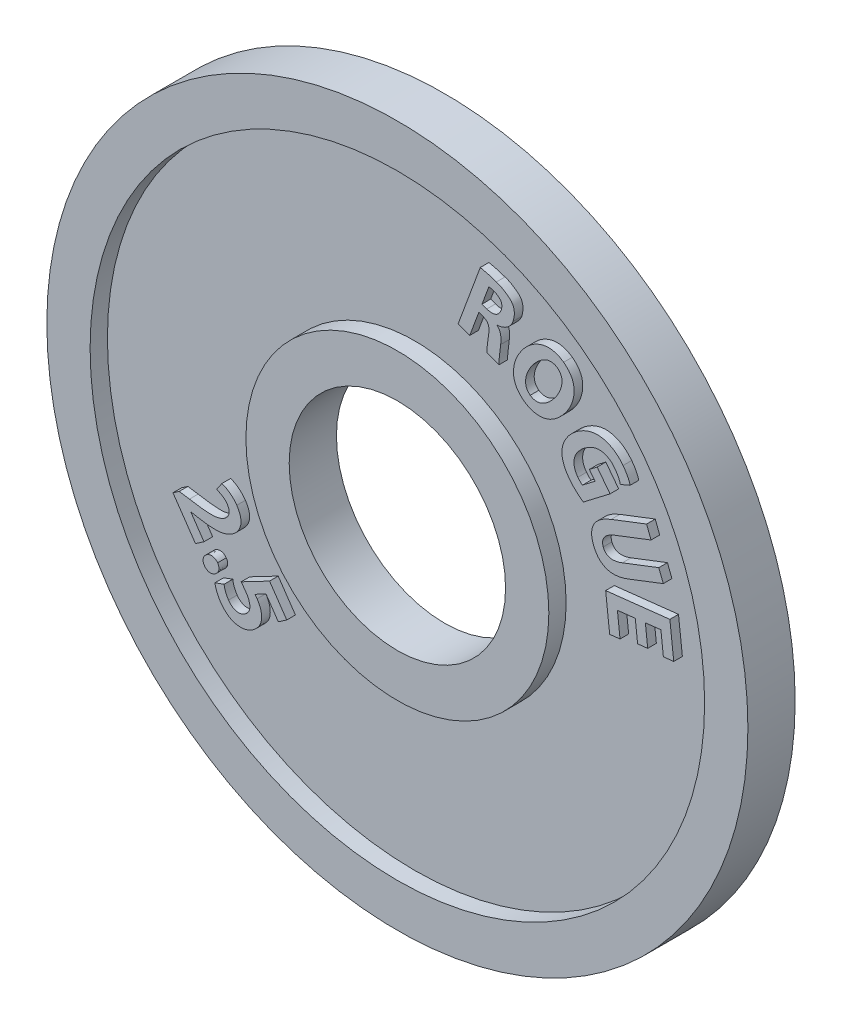
from build123d import *

# Parameters (mm, degrees)
BOSS_EXTRUDE1_DEPTH      = 5.461
BOSS_EXTRUDE1_DEPTH_BACK = 5.461
SKETCH1_R                = 81
SKETCH1_R_2              = 25
SKETCH2_R                = 71
SKETCH2_R_2              = 35
CUT_EXTRUDE1_DEPTH       = 4.0005
BOSS_EXTRUDE2_DEPTH      = 2
BOSS_EXTRUDE3_DEPTH      = 2


with BuildPart() as part:
    # Sketch1 → Boss-Extrude1 (new, two sides: drawn at the far end of the back side and taken through both)
    with BuildSketch(Plane.XY.offset(-BOSS_EXTRUDE1_DEPTH_BACK)):
        Circle(SKETCH1_R)
        Circle(SKETCH1_R_2, mode=Mode.SUBTRACT)
    extrude(amount=BOSS_EXTRUDE1_DEPTH + BOSS_EXTRUDE1_DEPTH_BACK)

    # Sketch2 → Cut-Extrude1 (cut)
    with BuildSketch(Plane.XY.offset(5.461)):
        Circle(SKETCH2_R)
        Circle(SKETCH2_R_2, mode=Mode.SUBTRACT)
    cut_extrude1 = extrude(amount=-CUT_EXTRUDE1_DEPTH, mode=Mode.SUBTRACT)

    # Mirror1: Cut-Extrude1 across plane
    add(cut_extrude1.mirror(Plane.XY), mode=Mode.SUBTRACT)

    # Sketch3 → Boss-Extrude2 (add)
    # profile 1 of 5: a face of its own
    with BuildSketch(Plane.XY.offset(1.4605)):
        Polygon((48.839860313, 6.484164034), (52.968569495, 6.947410841), (53.511910375, 2.104859417), (55.846367436, 2.366788686), (55.303026555, 7.20934011), (58.891530797, 7.611975185), (59.467342249, 2.480028258), (61.85967841, 2.748451641), (60.963490663, 10.735767535), (46.127147855, 9.071109617), (47.057970878, 0.775105187), (49.450307039, 1.04352857), align=None)
    # profile 2 of 5: a face of its own
    with BuildSketch(Plane.XY.offset(1.4605)):
        with BuildLine():
            Line((58.408868098, 19.800082667), (49.987467181, 16.550679829))
            add(Edge.make_bspline(
                [(49.987467181, 16.550679829), (49.837686292, 16.49488334), (49.548503275, 16.387156666), (49.120650997, 16.259060183), (48.718130875, 16.157531015), (48.3383113, 16.094060034), (47.983737391, 16.055501164), (47.652478383, 16.047671174), (47.345604822, 16.076303263), (47.061807344, 16.131748126), (46.800297945, 16.216353411), (46.561420144, 16.329299607), (46.342241739, 16.4653803), (46.142932545, 16.625909936), (45.969496065, 16.816772156), (45.812660014, 17.029630844), (45.677584634, 17.26830529), (45.607777094, 17.441104297), (45.572237794, 17.52907697)],
                knots=[0, 0, 0, 0, 1.497104005, 2.890469246, 4.182170157, 5.38371335, 6.495092621, 7.521788302, 8.482159144, 9.376924377, 10.225954568, 11.05018717, 11.846294255, 12.63832965, 13.439256997, 14.255276399, 15.111754169, 16, 16, 16, 16], degree=3))
            add(Edge.make_bspline(
                [(45.572237794, 17.52907697), (45.54110301, 17.614613658), (45.479774266, 17.783102301), (45.425508923, 18.04191056), (45.396491838, 18.297399563), (45.411182685, 18.549352457), (45.448399927, 18.799047872), (45.523898445, 19.044679467), (45.628212982, 19.288379268), (45.767214883, 19.527576303), (45.939321995, 19.76221404), (46.150349026, 19.988333827), (46.399430665, 20.207407096), (46.68514051, 20.419636496), (47.00915993, 20.62261618), (47.369864522, 20.818593857), (47.768038655, 21.009888345), (48.05044791, 21.124827032), (48.196265949, 21.184174004)],
                knots=[0, 0, 0, 0, 0.860359369, 1.694720544, 2.496292306, 3.285820064, 4.075497019, 4.880198023, 5.709886719, 6.579371814, 7.492216528, 8.457987856, 9.500110658, 10.627382014, 11.822294646, 13.115197334, 14.510472797, 16, 16, 16, 16], degree=3))
            Line((48.196265949, 21.184174004), (56.619949546, 24.436380807))
            Line((56.619949546, 24.436380807), (55.585731009, 27.116740669))
            Line((55.585731009, 27.116740669), (47.399767106, 23.958181351))
            add(Edge.make_bspline(
                [(47.399767106, 23.958181351), (47.154468324, 23.857841529), (46.680005497, 23.663761822), (46.013535972, 23.332747275), (45.408284071, 22.990328032), (44.872169211, 22.619822167), (44.397428848, 22.23386378), (43.988947507, 21.825444317), (43.64911132, 21.394638236), (43.369378637, 20.946391713), (43.160285524, 20.475854365), (43.000879597, 19.991825463), (42.911244595, 19.488861108), (42.872193892, 18.97068588), (42.901362444, 18.436644787), (42.982505426, 17.885841772), (43.12766595, 17.319156982), (43.263407489, 16.943659535), (43.333104561, 16.75085877)],
                knots=[0, 0, 0, 0, 1.344863254, 2.601266986, 3.774593576, 4.87164201, 5.905128389, 6.876547377, 7.797123993, 8.68497585, 9.55087214, 10.40474598, 11.26530219, 12.137400202, 13.036845566, 13.973989001, 14.959736017, 16, 16, 16, 16], degree=3))
            add(Edge.make_bspline(
                [(43.333104561, 16.75085877), (43.410974278, 16.558161721), (43.562516745, 16.183153476), (43.844818406, 15.660755193), (44.154999178, 15.184613707), (44.505743366, 14.763642724), (44.882641693, 14.386507135), (45.300458995, 14.06841769), (45.749073959, 13.796649982), (46.232035934, 13.575774786), (46.748993972, 13.412846067), (47.299529988, 13.307875723), (47.882920851, 13.26868844), (48.499149791, 13.285968288), (49.147370666, 13.367682561), (49.828539989, 13.507641829), (50.544515776, 13.703666651), (51.024632026, 13.877108014), (51.272615873, 13.966691852)],
                knots=[0, 0, 0, 0, 1.039558933, 2.023088435, 2.966935064, 3.879187077, 4.760868502, 5.629975167, 6.500584746, 7.381580594, 8.281428687, 9.207176976, 10.180014645, 11.202256596, 12.288320077, 13.445692329, 14.680679849, 16, 16, 16, 16], degree=3))
            Line((51.272615873, 13.966691852), (59.443086636, 17.119722805))
            Line((59.443086636, 17.119722805), (58.408868098, 19.800082667))
        make_face()
    # profile 3 of 5: a face of its own
    with BuildSketch(Plane.XY.offset(1.4605)):
        with BuildLine():
            Line((44.16869194, 32.812577076), (42.364340607, 31.432911175))
            Line((42.364340607, 31.432911175), (43.67325441, 29.72109068))
            Line((43.67325441, 29.72109068), (40.773954833, 27.504191626))
            add(Edge.make_bspline(
                [(40.773954833, 27.504191626), (40.738610855, 27.523476593), (40.66310176, 27.564677116), (40.549992084, 27.645146529), (40.430183159, 27.747061059), (40.30098144, 27.868198142), (40.163522503, 28.009091505), (40.017629222, 28.169555821), (39.863059002, 28.349445795), (39.759411543, 28.477686355), (39.705441227, 28.544462558)],
                knots=[0, 0, 0, 0, 0.643595579, 1.374981614, 2.215029152, 3.158253785, 4.206916651, 5.362660204, 6.626709559, 8, 8, 8, 8], degree=3))
            add(Edge.make_bspline(
                [(39.705441227, 28.544462558), (39.614773346, 28.66915258), (39.437486609, 28.912964246), (39.220660412, 29.301883288), (39.047396584, 29.696763542), (38.92006783, 30.100854635), (38.838237374, 30.512561551), (38.801731284, 30.931718599), (38.809722034, 31.357619845), (38.867480914, 31.788785059), (38.969712517, 32.223645464), (39.132564733, 32.65460533), (39.347717872, 33.080901592), (39.617738585, 33.501167657), (39.940057359, 33.917692646), (40.315146854, 34.330542904), (40.744066858, 34.740171787), (41.059601631, 34.997125753), (41.222545299, 35.129818013)],
                knots=[0, 0, 0, 0, 0.969838496, 1.89636616, 2.796694835, 3.680522693, 4.558095135, 5.434002503, 6.324412732, 7.234112482, 8.167870944, 9.130460798, 10.127095065, 11.168898237, 12.27028591, 13.439011954, 14.677493503, 16, 16, 16, 16], degree=3))
            add(Edge.make_bspline(
                [(41.222545299, 35.129818013), (41.399797573, 35.255837283), (41.743461416, 35.500168518), (42.269656802, 35.816021877), (42.78549073, 36.073081199), (43.287955363, 36.275970198), (43.781801921, 36.414826644), (44.262914883, 36.498650257), (44.734734967, 36.52160575), (45.192947128, 36.487492947), (45.636320671, 36.402214992), (46.06246915, 36.272006983), (46.471404476, 36.100446706), (46.861196201, 35.885603735), (47.232371181, 35.626778461), (47.585796038, 35.325586477), (47.922608537, 34.982084515), (48.123947555, 34.726311971), (48.2265091, 34.596022135)],
                knots=[0, 0, 0, 0, 1.310022954, 2.539925234, 3.693103949, 4.779644539, 5.799610008, 6.778238225, 7.715964785, 8.638166047, 9.540051399, 10.43071203, 11.318311194, 12.207236498, 13.107231306, 14.039936651, 15.001549085, 16, 16, 16, 16], degree=3))
            add(Edge.make_bspline(
                [(48.2265091, 34.596022135), (48.320225569, 34.469387669), (48.500316598, 34.226039498), (48.743774439, 33.863788354), (48.946479695, 33.516624361), (49.116433357, 33.187453668), (49.254536827, 32.872136961), (49.370736923, 32.572723454), (49.461939793, 32.283421969), (49.507726548, 32.093077686), (49.530094822, 32.0000885)],
                knots=[0, 0, 0, 0, 1.291249817, 2.481340918, 3.575365574, 4.584676589, 5.516049243, 6.395623355, 7.216211412, 8, 8, 8, 8], degree=3))
            Line((49.530094822, 32.0000885), (51.777730488, 32.960995157))
            add(Edge.make_bspline(
                [(51.777730488, 32.960995157), (51.753278135, 33.06543467), (51.701532148, 33.28644921), (51.581143998, 33.626284956), (51.434492626, 33.997530432), (51.244093873, 34.39065529), (51.024657965, 34.806128141), (50.763154453, 35.232389935), (50.473185253, 35.673633151), (50.25823856, 35.964292792), (50.148174259, 36.113126208)],
                knots=[0, 0, 0, 0, 0.719887839, 1.523424185, 2.418065561, 3.399918859, 4.455081644, 5.57256837, 6.757024066, 8, 8, 8, 8], degree=3))
            add(Edge.make_bspline(
                [(50.148174259, 36.113126208), (49.979273184, 36.323034979), (49.648392634, 36.734250419), (49.102977874, 37.290179534), (48.52964159, 37.777576835), (47.934817295, 38.20583174), (47.307878407, 38.56072136), (46.65737439, 38.856016632), (45.977150774, 39.080376087), (45.274686756, 39.238937862), (44.555016843, 39.321959247), (43.825241714, 39.318332401), (43.089040233, 39.230200763), (42.347690801, 39.054162925), (41.601011185, 38.789117071), (40.849931541, 38.436329223), (40.08883504, 38.004947989), (39.5996458, 37.660748781), (39.348640825, 37.484138777)],
                knots=[0, 0, 0, 0, 1.053233118, 2.06330453, 3.040160319, 3.993435427, 4.92516272, 5.852994695, 6.783021597, 7.721340968, 8.664942069, 9.609878509, 10.568877611, 11.558523274, 12.583668212, 13.661873605, 14.800297901, 16, 16, 16, 16], degree=3))
            add(Edge.make_bspline(
                [(39.348640825, 37.484138777), (39.120753586, 37.301412266), (38.674731031, 36.943778613), (38.071250136, 36.355967538), (37.540755342, 35.741639648), (37.081782273, 35.105366161), (36.70088569, 34.45182202), (36.4047899, 33.787595812), (36.182568695, 33.118027858), (36.107299946, 32.661651298), (36.070010357, 32.435553558)],
                knots=[0, 0, 0, 0, 1.135022622, 2.221474505, 3.269477635, 4.286871483, 5.267219066, 6.204267615, 7.110359581, 8, 8, 8, 8], degree=3))
            add(Edge.make_bspline(
                [(36.070010357, 32.435553558), (36.049692468, 32.218474497), (36.00890752, 31.782722631), (36.044636743, 31.122301589), (36.151238345, 30.460879212), (36.3379114, 29.799002067), (36.595366591, 29.134391198), (36.925615945, 28.465950745), (37.335451503, 27.798309698), (37.653978927, 27.368698452), (37.817489492, 27.148164921)],
                knots=[0, 0, 0, 0, 0.914260576, 1.835233436, 2.767241799, 3.722031481, 4.71643714, 5.755542836, 6.847846585, 8, 8, 8, 8], degree=3))
            add(Edge.make_bspline(
                [(37.817489492, 27.148164921), (37.950878893, 26.983042517), (38.213896001, 26.6574543), (38.628293019, 26.197111981), (39.049255978, 25.764917223), (39.47848842, 25.372324403), (39.893681252, 25.016199975), (40.286009743, 24.708479395), (40.640130921, 24.439015589), (40.875962249, 24.290404561), (40.986551333, 24.220715951)],
                knots=[0, 0, 0, 0, 1.175329599, 2.317513915, 3.428712947, 4.515079153, 5.537732409, 6.457023262, 7.276447344, 8, 8, 8, 8], degree=3))
            Line((40.986551333, 24.220715951), (47.140280034, 28.926281898))
            Line((47.140280034, 28.926281898), (44.16869194, 32.812577076))
        make_face()
    # profile 4 of 5: a face of its own
    with BuildSketch(Plane.XY.offset(1.4605)):
        with BuildLine():
            add(Edge.make_bspline(
                [(36.429108033, 49.921494922), (36.226602857, 50.052753595), (35.831402866, 50.308912115), (35.211125728, 50.620740694), (34.585733375, 50.855488936), (33.953544074, 51.015551602), (33.3149777, 51.09738957), (32.66993845, 51.102815034), (32.019525905, 51.031381755), (31.368293924, 50.883763698), (30.724401246, 50.667141191), (30.094660335, 50.386961728), (29.483327647, 50.04583971), (28.890661768, 49.640938496), (28.3160005, 49.173335492), (27.76433584, 48.638481295), (27.223001298, 48.048899726), (26.892336598, 47.616776168), (26.723296453, 47.39586892)],
                knots=[0, 0, 0, 0, 1.030111454, 2.010319163, 2.958269628, 3.87788443, 4.789216449, 5.701171409, 6.62650893, 7.577450089, 8.547552463, 9.523417539, 10.517151137, 11.533321662, 12.58525205, 13.677163438, 14.812535389, 16, 16, 16, 16], degree=3))
            add(Edge.make_bspline(
                [(26.723296453, 47.39586892), (26.569724329, 47.172942409), (26.268964453, 46.736356989), (25.874561107, 46.064283796), (25.544522437, 45.392324007), (25.271616971, 44.723240486), (25.066168258, 44.052544755), (24.922162796, 43.383239442), (24.835920684, 42.716020665), (24.815653275, 42.053460231), (24.862058646, 41.40433372), (24.9787738, 40.775267501), (25.174296292, 40.174596999), (25.442073741, 39.600661908), (25.780554488, 39.052865125), (26.196182564, 38.535251507), (26.677242987, 38.037587111), (27.045632714, 37.744199065), (27.234616714, 37.593690941)],
                knots=[0, 0, 0, 0, 1.178431314, 2.30787234, 3.389271438, 4.435718577, 5.450815921, 6.439333228, 7.41344, 8.376180832, 9.320657633, 10.241946446, 11.154913875, 12.063408408, 12.99356996, 13.951350029, 14.949042173, 16, 16, 16, 16], degree=3))
            add(Edge.make_bspline(
                [(27.234616714, 37.593690941), (27.424213856, 37.463469992), (27.79660209, 37.20770269), (28.385274102, 36.895907384), (28.98334655, 36.65467277), (29.588433196, 36.48066795), (30.204451119, 36.383020363), (30.827208922, 36.351012979), (31.459316783, 36.39228035), (32.097661526, 36.501115112), (32.737210723, 36.687285685), (33.371276673, 36.954450057), (33.996574213, 37.303895982), (34.615795135, 37.730523323), (35.227539843, 38.23646288), (35.82759794, 38.825227284), (36.425548, 39.488095342), (36.799367109, 39.973438725), (36.991843461, 40.223338)],
                knots=[0, 0, 0, 0, 0.966955573, 1.899199931, 2.795320379, 3.675716969, 4.541610495, 5.413291475, 6.293502962, 7.200844283, 8.132114304, 9.089083949, 10.088887692, 11.140053054, 12.248203124, 13.423829552, 14.673551247, 16, 16, 16, 16], degree=3))
            add(Edge.make_bspline(
                [(36.991843461, 40.223338), (37.135978126, 40.430386332), (37.419262707, 40.837322444), (37.790901912, 41.468760059), (38.107282391, 42.104947262), (38.367342589, 42.747228164), (38.56981823, 43.395843502), (38.720240025, 44.048425065), (38.812792042, 44.706351567), (38.851735921, 45.364368343), (38.823100998, 46.015809577), (38.717177511, 46.649772959), (38.528687008, 47.258893655), (38.266310311, 47.844953949), (37.921576683, 48.405070246), (37.499680289, 48.940600324), (36.999469393, 49.452046287), (36.621384978, 49.76036015), (36.427143612, 49.918756803)],
                knots=[0, 0, 0, 0, 1.109855385, 2.181327574, 3.22077945, 4.233987247, 5.227185195, 6.207899113, 7.177685735, 8.147612443, 9.104769385, 10.041072688, 10.967905201, 11.903101408, 12.859370779, 13.854422275, 14.89770662, 16, 16, 16, 16], degree=3))
            Line((36.427143612, 49.918756803), (36.429108033, 49.921494922))
        make_face()
        with BuildLine():
            add(Edge.make_bspline(
                [(34.985590203, 48.066573453), (35.086078988, 47.979111313), (35.282250135, 47.808370388), (35.536882197, 47.519663068), (35.735919083, 47.205339193), (35.8918562, 46.87171675), (35.994659755, 46.515306079), (36.051884996, 46.137491942), (36.055227043, 45.738074129), (36.011232969, 45.322497813), (35.927859413, 44.896980905), (35.816483029, 44.467716396), (35.671121619, 44.038493833), (35.497843195, 43.609203413), (35.290466994, 43.180446693), (35.054436818, 42.750824184), (34.787722073, 42.319923486), (34.589411571, 42.040026787), (34.488621742, 41.897771383)],
                knots=[0, 0, 0, 0, 0.931332739, 1.818119406, 2.681290799, 3.525434925, 4.385693009, 5.266750894, 6.190512612, 7.171521792, 8.185210442, 9.221176022, 10.271458129, 11.35290284, 12.457511657, 13.600910515, 14.780680707, 16, 16, 16, 16], degree=3))
            add(Edge.make_bspline(
                [(34.488621742, 41.897771383), (34.376148508, 41.746522684), (34.155811075, 41.450223298), (33.802189366, 41.038970274), (33.448877301, 40.656402215), (33.086715955, 40.312200355), (32.721053692, 39.999863056), (32.34611988, 39.727378838), (31.966126829, 39.487836475), (31.584064642, 39.281498793), (31.200645523, 39.120544229), (30.821084109, 39.008793938), (30.44723401, 38.947411133), (30.079218245, 38.94223699), (29.718656592, 38.986968226), (29.366580258, 39.085058323), (29.019181644, 39.230902552), (28.803343364, 39.366959677), (28.692722295, 39.436691444)],
                knots=[0, 0, 0, 0, 1.29445216, 2.535859027, 3.723890248, 4.87059841, 5.966176391, 7.025217737, 8.051550492, 9.050249909, 10.004875846, 10.902729033, 11.762624791, 12.599072967, 13.422580392, 14.249773667, 15.102976963, 16, 16, 16, 16], degree=3))
            add(Edge.make_bspline(
                [(28.692722295, 39.436691444), (28.594023641, 39.520489347), (28.401135674, 39.684256597), (28.15384921, 39.9664142), (27.951759932, 40.27110336), (27.800494556, 40.601800526), (27.687332117, 40.952010423), (27.632151594, 41.328270495), (27.613569297, 41.72493815), (27.648542788, 42.140682286), (27.718013975, 42.568166543), (27.827107872, 43.002219815), (27.966524948, 43.441394405), (28.146239141, 43.881683752), (28.353095939, 44.327906367), (28.600629032, 44.774264291), (28.876955068, 45.228260445), (29.08608666, 45.523179928), (29.192804748, 45.673674853)],
                knots=[0, 0, 0, 0, 0.895120354, 1.749344489, 2.587057322, 3.416378577, 4.258891809, 5.125202031, 6.039913006, 7.001812923, 8.006625255, 9.034706051, 10.096476955, 11.192933863, 12.323755872, 13.498490079, 14.72350058, 16, 16, 16, 16], degree=3))
            add(Edge.make_bspline(
                [(29.192804748, 45.673674853), (29.297156668, 45.814360502), (29.502107737, 46.090672375), (29.830117134, 46.479323706), (30.1662104, 46.840073915), (30.51577763, 47.168739401), (30.872936385, 47.469999235), (31.23811151, 47.744613975), (31.616580699, 47.985990462), (32.000080163, 48.199920383), (32.387980184, 48.372831782), (32.775505489, 48.492833651), (33.157984795, 48.558778725), (33.536593821, 48.571760608), (33.909088658, 48.524779083), (34.277197598, 48.428315528), (34.639528109, 48.275692795), (34.866783891, 48.136005477), (34.983085291, 48.064518493)],
                knots=[0, 0, 0, 0, 1.209266702, 2.375044979, 3.509629367, 4.612080738, 5.68596051, 6.734842066, 7.764470177, 8.783237876, 9.764837457, 10.691454923, 11.577021534, 12.437464808, 13.29730038, 14.159976306, 15.058341531, 16, 16, 16, 16], degree=3))
            Line((34.983085291, 48.064518493), (34.985590203, 48.066573453))
        make_face(mode=Mode.SUBTRACT)
    # profile 5 of 5: a face of its own
    with BuildSketch(Plane.XY.offset(1.4605)):
        with BuildLine():
            Line((12.048639674, 45.421593799), (14.725408156, 44.431467744))
            Line((14.725408156, 44.431467744), (16.82690019, 50.112772279))
            Line((16.82690019, 50.112772279), (17.737365661, 49.775994709))
            add(Edge.make_bspline(
                [(17.737365661, 49.775994709), (17.812829656, 49.748120255), (17.960613865, 49.693532578), (18.167682644, 49.592883023), (18.354773347, 49.478721023), (18.525044421, 49.356964603), (18.671440315, 49.217427327), (18.799170897, 49.068042211), (18.906458179, 48.906690072), (18.995764115, 48.732833825), (19.062677732, 48.539564515), (19.116707729, 48.327411523), (19.147713936, 48.091745721), (19.169057235, 47.834811356), (19.166834124, 47.555026295), (19.149647417, 47.253175667), (19.115832212, 46.929713207), (19.081384241, 46.707650828), (19.063536742, 46.592600274)],
                knots=[0, 0, 0, 0, 1.003301284, 1.964805674, 2.866522433, 3.735864784, 4.570680603, 5.383036093, 6.183456355, 6.982938007, 7.814476814, 8.729792401, 9.709650317, 10.776038435, 11.944441794, 13.196597383, 14.547556662, 16, 16, 16, 16], degree=3))
            add(Edge.make_bspline(
                [(19.063536742, 46.592600274), (19.02953725, 46.372572559), (18.964331009, 45.950590367), (18.875274004, 45.344209415), (18.80838898, 44.790439929), (18.757047188, 44.293125993), (18.72406694, 43.858331107), (18.702684143, 43.492206902), (18.696959606, 43.198571426), (18.707751902, 43.027379912), (18.712355244, 42.954359952)],
                knots=[0, 0, 0, 0, 1.459571406, 2.799252546, 4.01764122, 5.116013838, 6.076577459, 6.875845538, 7.520503606, 8, 8, 8, 8], degree=3))
            Line((18.712355244, 42.954359952), (21.481061945, 41.932578178))
            add(Edge.make_bspline(
                [(21.481061945, 41.932578178), (21.477197189, 41.978153089), (21.468898553, 42.076014256), (21.46867254, 42.234213195), (21.466548434, 42.413157539), (21.476838572, 42.612666322), (21.490708817, 42.832760737), (21.510567834, 43.073463828), (21.535981674, 43.33569016), (21.578545662, 43.716702211), (21.63378748, 44.220860434), (21.712589402, 44.847629564), (21.785363872, 45.503868539), (21.841505962, 45.949304798), (21.870179276, 46.17680138)],
                knots=[0, 0, 0, 0, 0.385738452, 0.828280615, 1.333962467, 1.895453835, 2.513018525, 3.194775745, 3.933027548, 4.735775713, 6.429397854, 8.212095189, 10.06541255, 12, 12, 12, 12], degree=3))
            add(Edge.make_bspline(
                [(21.870179276, 46.17680138), (21.891652326, 46.362914254), (21.933102276, 46.722172463), (21.948699535, 47.245813551), (21.916543446, 47.732499657), (21.851503694, 48.184390571), (21.72932697, 48.60083321), (21.556233496, 48.980970146), (21.321933558, 49.322486692), (21.127994659, 49.515424619), (21.030153132, 49.612761159)],
                knots=[0, 0, 0, 0, 1.219651072, 2.354322141, 3.405351762, 4.392899107, 5.321045177, 6.221430535, 7.102717644, 8, 8, 8, 8], degree=3))
            Line((21.030153132, 49.612761159), (21.050993559, 49.668138091))
            add(Edge.make_bspline(
                [(21.050993559, 49.668138091), (21.240552231, 49.677333567), (21.619725996, 49.695727255), (22.174418914, 49.832407368), (22.713800583, 50.035910794), (23.141134927, 50.270486771), (23.46573702, 50.497497678), (23.696756131, 50.688376771), (23.910849785, 50.900913282), (24.110849155, 51.131263111), (24.294777126, 51.382727372), (24.458897814, 51.655443315), (24.610061564, 51.946983753), (24.695162932, 52.151828102), (24.738629754, 52.256455478)],
                knots=[0, 0, 0, 0, 1.423198096, 2.846819796, 4.270093592, 5.74718617, 6.494920337, 7.244572708, 7.995973637, 8.759275322, 9.534837986, 10.333801071, 11.148963489, 12, 12, 12, 12], degree=3))
            add(Edge.make_bspline(
                [(24.738629754, 52.256455478), (24.771650434, 52.369454496), (24.836473667, 52.591284017), (24.911454715, 52.921630881), (24.968002381, 53.241425033), (25.008147961, 53.548834052), (25.028258817, 53.846264793), (25.028881046, 54.13260671), (25.008492805, 54.408444609), (24.973176349, 54.673549257), (24.916760929, 54.927296963), (24.841083021, 55.170000062), (24.744718063, 55.400606853), (24.631874771, 55.621881569), (24.500221222, 55.831448339), (24.350385748, 56.031193842), (24.177252648, 56.215514581), (23.928011362, 56.448887747), (23.598494518, 56.712345084), (23.2073416, 57.012729916), (22.81390758, 57.279549479), (22.42519441, 57.523465182), (22.033473744, 57.731693578), (21.64855987, 57.920452751), (21.262485445, 58.076026125), (21.001690276, 58.157960351), (20.872823821, 58.198446428)],
                knots=[0, 0, 0, 0, 1.046834569, 2.055051581, 3.010851844, 3.934427918, 4.810909927, 5.660463789, 6.478781403, 7.26915533, 8.037047447, 8.787809705, 9.527166136, 10.257269627, 10.99446488, 11.725755107, 12.474296443, 13.240289065, 14.761025685, 16.223606139, 17.625892267, 18.987288648, 20.302789718, 21.569366776, 22.798953654, 24, 24, 24, 24], degree=3))
            add(Edge.make_bspline(
                [(20.872823821, 58.198446428), (20.534846764, 58.318581904), (19.87549059, 58.552953043), (19.049245281, 58.798272996), (18.41616115, 58.963312934), (17.975132346, 59.075547677), (17.558547323, 59.164578875), (17.288989457, 59.215935524), (17.158728296, 59.240753115)],
                knots=[0, 0, 0, 0, 1.671610268, 3.261128318, 4.014928245, 4.721030707, 5.381950794, 6, 6, 6, 6], degree=3))
            Line((17.158728296, 59.240753115), (12.048639674, 45.421593799))
        make_face()
        with BuildLine():
            add(Edge.make_bspline(
                [(19.143929869, 56.376774714), (19.216585283, 56.368001169), (19.386504624, 56.347482465), (19.673866206, 56.279779831), (20.025592783, 56.167095594), (20.281242747, 56.076234491), (20.420502051, 56.026740043)],
                knots=[0, 0, 0, 0, 0.661387637, 1.546788406, 2.663670691, 4, 4, 4, 4], degree=3))
            add(Edge.make_bspline(
                [(20.420502051, 56.026740043), (20.551472957, 55.978168073), (20.81411264, 55.880765319), (21.178914966, 55.663261779), (21.512587128, 55.387893955), (21.767989518, 55.122681889), (21.944306548, 54.877383835), (22.042480842, 54.667883759), (22.106550936, 54.438001892), (22.143547379, 54.190756193), (22.145148787, 53.922437731), (22.111301974, 53.636937033), (22.053385678, 53.329822927), (21.990275149, 53.123107012), (21.957272288, 53.015007514)],
                knots=[0, 0, 0, 0, 1.302900908, 2.612744265, 3.943542736, 5.336084444, 6.039885428, 6.756029539, 7.484255063, 8.262472932, 9.084872822, 9.982387724, 10.944914927, 12, 12, 12, 12], degree=3))
            add(Edge.make_bspline(
                [(21.957272288, 53.015007514), (21.923923586, 52.933889783), (21.858704768, 52.775250849), (21.741039614, 52.552126879), (21.605009159, 52.351578489), (21.454660313, 52.170775852), (21.292587614, 52.005983269), (21.111716028, 51.865129811), (20.915207077, 51.747365487), (20.707599216, 51.644750624), (20.486001192, 51.566693667), (20.253314575, 51.512526692), (20.011978062, 51.485720892), (19.761962474, 51.480485127), (19.502052394, 51.49627213), (19.23380909, 51.543435377), (18.955906486, 51.610921913), (18.770972085, 51.67171722), (18.675832368, 51.702993436)],
                knots=[0, 0, 0, 0, 1.056297934, 2.065762638, 3.032717876, 3.970263286, 4.895714355, 5.81204201, 6.723424601, 7.651896887, 8.597553871, 9.547240662, 10.524084766, 11.51721288, 12.557420266, 13.655493523, 14.793865928, 16, 16, 16, 16], degree=3))
            Line((18.675832368, 51.702993436), (17.567810844, 52.115796313))
            Line((17.567810844, 52.115796313), (19.143929869, 56.376774714))
        make_face(mode=Mode.SUBTRACT)
    extrude(amount=BOSS_EXTRUDE2_DEPTH)

    # Sketch4 → Boss-Extrude3 (add)
    with BuildSketch(Plane.XY.offset(1.4605)):
        with BuildLine():
            Line((-49.740504269, -23.112347062), (-49.708502855, -23.09035432))
            Line((-49.708502855, -23.09035432), (-48.023687668, -23.416623881))
            add(Edge.make_bspline(
                [(-48.023687668, -23.416623881), (-47.654604906, -23.486091958), (-46.928480085, -23.622761832), (-45.84648317, -23.751460607), (-44.795530575, -23.826495948), (-43.93881113, -23.839987312), (-43.271120797, -23.809204028), (-42.785527384, -23.753494657), (-42.312769046, -23.66241939), (-41.85105615, -23.543004769), (-41.402867733, -23.386834787), (-40.966718469, -23.200554488), (-40.540232167, -22.986248546), (-40.270594101, -22.815736713), (-40.135185469, -22.73010795)],
                knots=[0, 0, 0, 0, 1.662567002, 3.270895553, 4.821364675, 6.326705224, 7.061617899, 7.779654454, 8.48882364, 9.19186832, 9.889523817, 10.588102963, 11.290964184, 12, 12, 12, 12], degree=3))
            add(Edge.make_bspline(
                [(-40.135185469, -22.73010795), (-40.012899284, -22.642117284), (-39.772571859, -22.469190389), (-39.443503695, -22.181557707), (-39.148060774, -21.876202634), (-38.888999444, -21.551330651), (-38.67000101, -21.204600494), (-38.478921364, -20.844538647), (-38.327305224, -20.46285821), (-38.212008532, -20.064271321), (-38.136325795, -19.650328722), (-38.117475769, -19.223380632), (-38.153141797, -18.787092827), (-38.238114918, -18.340469563), (-38.378086051, -17.883466179), (-38.570596204, -17.416475594), (-38.816662176, -16.940001041), (-39.01187921, -16.62847908), (-39.112544946, -16.467839473)],
                knots=[0, 0, 0, 0, 1.007642039, 1.980305611, 2.919845804, 3.847609738, 4.755003344, 5.660339045, 6.571468263, 7.497643649, 8.433100004, 9.380340623, 10.348289522, 11.356067946, 12.416643528, 13.540757201, 14.731865337, 16, 16, 16, 16], degree=3))
            add(Edge.make_bspline(
                [(-39.112544946, -16.467839473), (-39.237219761, -16.298993728), (-39.481327345, -15.968401482), (-39.887622894, -15.516547742), (-40.312894018, -15.109687081), (-40.763570834, -14.759205026), (-41.214545464, -14.452051529), (-41.659633226, -14.191344112), (-42.095319007, -13.980243818), (-42.389251283, -13.875088225), (-42.531648013, -13.824145154)],
                knots=[0, 0, 0, 0, 1.146233191, 2.244272159, 3.315650652, 4.357742706, 5.359716491, 6.295257541, 7.174130333, 8, 8, 8, 8], degree=3))
            Line((-42.531648013, -13.824145154), (-43.776652271, -15.644955376))
            add(Edge.make_bspline(
                [(-43.776652271, -15.644955376), (-43.67205892, -15.681970764), (-43.458692904, -15.757480592), (-43.140853596, -15.898016458), (-42.813725705, -16.056774088), (-42.486121955, -16.244037755), (-42.161584281, -16.452703757), (-41.86416466, -16.70291079), (-41.587476823, -16.981193747), (-41.428979896, -17.190722805), (-41.348868727, -17.296627809)],
                knots=[0, 0, 0, 0, 0.891818484, 1.819272029, 2.792518002, 3.814308011, 4.85228471, 5.889687662, 6.93335732, 8, 8, 8, 8], degree=3))
            add(Edge.make_bspline(
                [(-41.348868727, -17.296627809), (-41.297165832, -17.379287671), (-41.197484324, -17.538653209), (-41.070886911, -17.781564561), (-40.979910308, -18.02107324), (-40.909299561, -18.253342873), (-40.870246729, -18.481632317), (-40.857060279, -18.7054014), (-40.878396117, -18.923409643), (-40.938171794, -19.203492341), (-41.070252282, -19.538065766), (-41.305952563, -19.903996279), (-41.610433124, -20.239813941), (-41.858472417, -20.422091607), (-41.986614328, -20.516259785)],
                knots=[0, 0, 0, 0, 0.942916782, 1.817913036, 2.643806138, 3.417697963, 4.162251255, 4.878727682, 5.579048093, 6.27366351, 7.644524623, 9.029052554, 10.465150925, 12, 12, 12, 12], degree=3))
            add(Edge.make_bspline(
                [(-41.986614328, -20.516259785), (-42.089404522, -20.581040335), (-42.297861433, -20.71241428), (-42.63644298, -20.87390827), (-42.997892267, -21.008388331), (-43.381747138, -21.118894281), (-43.789697127, -21.199481684), (-44.22077842, -21.251677746), (-44.674829554, -21.279582711), (-45.153082298, -21.281162192), (-45.659003218, -21.259895439), (-46.193568774, -21.221358186), (-46.759868579, -21.176496561), (-47.354866236, -21.105115483), (-47.981983914, -21.028935182), (-48.639096853, -20.931494923), (-49.327567192, -20.822579278), (-49.796063553, -20.740736064), (-50.035694267, -20.698874164)],
                knots=[0, 0, 0, 0, 0.708203609, 1.436225873, 2.182942276, 2.955754127, 3.76347062, 4.605619488, 5.486741945, 6.415346295, 7.393842482, 8.439552499, 9.541391457, 10.706792508, 11.934446159, 13.22604246, 14.581151352, 16, 16, 16, 16], degree=3))
            Line((-50.035694267, -20.698874164), (-52.396819173, -20.344093055))
            Line((-52.396819173, -20.344093055), (-53.852883511, -21.344762786))
            Line((-53.852883511, -21.344762786), (-48.651600187, -28.913097203))
            Line((-48.651600187, -28.913097203), (-46.683513225, -27.560543612))
            Line((-46.683513225, -27.560543612), (-49.740504269, -23.112347062))
        make_face()
        with BuildLine():
            add(Edge.make_bspline(
                [(-46.580655341, -32.300137168), (-46.50373578, -32.400509534), (-46.355345686, -32.594143827), (-46.07711707, -32.819291881), (-45.773169355, -32.976784854), (-45.445244321, -33.056656243), (-45.104374124, -33.073145584), (-44.759504682, -33.007782044), (-44.409663938, -32.885552962), (-44.194466222, -32.750753454), (-44.082503804, -32.680620373)],
                knots=[0, 0, 0, 0, 1.065846321, 2.056187449, 2.997939456, 3.936825646, 4.887617725, 5.859821074, 6.886514166, 8, 8, 8, 8], degree=3))
            add(Edge.make_bspline(
                [(-44.082503804, -32.680620373), (-43.976460303, -32.598813659), (-43.77300812, -32.441861519), (-43.526577759, -32.159689303), (-43.350466463, -31.853179469), (-43.245060781, -31.527534243), (-43.21206441, -31.191681815), (-43.244088959, -30.853921504), (-43.358641893, -30.521175775), (-43.480208729, -30.316816603), (-43.543089023, -30.211112077)],
                knots=[0, 0, 0, 0, 1.132363425, 2.172521714, 3.149457186, 4.107666217, 5.0484488, 5.989231383, 6.959932442, 8, 8, 8, 8], degree=3))
            add(Edge.make_bspline(
                [(-43.543089023, -30.211112077), (-43.618288113, -30.116074927), (-43.764366699, -29.931459761), (-44.037266673, -29.713961671), (-44.341454863, -29.560853595), (-44.672237211, -29.478645245), (-45.016857939, -29.457059034), (-45.366076528, -29.510728437), (-45.714761283, -29.632613436), (-45.929527521, -29.763887698), (-46.040691838, -29.831836059)],
                knots=[0, 0, 0, 0, 1.028776943, 1.998458762, 2.943051485, 3.905763708, 4.879759895, 5.862683524, 6.893711927, 8, 8, 8, 8], degree=3))
            add(Edge.make_bspline(
                [(-46.040691838, -29.831836059), (-46.142815556, -29.910041859), (-46.339936388, -30.060995946), (-46.581456813, -30.335105967), (-46.754872265, -30.639024279), (-46.869730353, -30.962256711), (-46.912680392, -31.300589146), (-46.881201787, -31.642101252), (-46.770262027, -31.982350284), (-46.647131187, -32.19200524), (-46.582916072, -32.301344355)],
                knots=[0, 0, 0, 0, 1.089116353, 2.102229796, 3.073544263, 4.04056316, 4.993156714, 5.942300753, 6.926870045, 8, 8, 8, 8], degree=3))
            Line((-46.582916072, -32.301344355), (-46.580655341, -32.300137168))
        make_face()
        with BuildLine():
            add(Edge.make_bspline(
                [(-38.106072498, -31.295340876), (-38.026590661, -31.387072497), (-37.859851081, -31.579510072), (-37.612026039, -31.890664427), (-37.352368912, -32.23370535), (-37.182209613, -32.477064002), (-37.094055215, -32.603140776)],
                knots=[0, 0, 0, 0, 0.880211955, 1.846537254, 2.884355931, 4, 4, 4, 4], degree=3))
            add(Edge.make_bspline(
                [(-37.094055215, -32.603140776), (-37.009923836, -32.728488041), (-36.846532025, -32.971925353), (-36.637418649, -33.343358735), (-36.458669081, -33.702238005), (-36.310453312, -34.047947927), (-36.203733183, -34.38642654), (-36.126378796, -34.71202611), (-36.082494702, -35.028156098), (-36.076682358, -35.332750865), (-36.105382426, -35.624745363), (-36.163297123, -35.904453912), (-36.256729611, -36.170940672), (-36.384833074, -36.422056132), (-36.543036386, -36.660695055), (-36.737307643, -36.883286295), (-36.961980309, -37.095897674), (-37.132811175, -37.219999479), (-37.220480554, -37.283687784)],
                knots=[0, 0, 0, 0, 1.365141915, 2.651246339, 3.852200992, 4.991268335, 6.049503222, 7.058442102, 8.01569928, 8.930756808, 9.807403599, 10.664722846, 11.508670375, 12.353510273, 13.208734304, 14.091743148, 15.020693986, 16, 16, 16, 16], degree=3))
            add(Edge.make_bspline(
                [(-37.220480554, -37.283687784), (-37.308357038, -37.338116549), (-37.479661767, -37.444218938), (-37.749621877, -37.56686028), (-38.015194214, -37.662962491), (-38.280279458, -37.730900393), (-38.544756869, -37.759359609), (-38.80874801, -37.764925185), (-39.070517864, -37.731510349), (-39.329774166, -37.673461898), (-39.580611779, -37.584866301), (-39.822731981, -37.479076762), (-40.053008611, -37.350860342), (-40.270531633, -37.202509904), (-40.478444487, -37.034595126), (-40.674353143, -36.847073033), (-40.858172306, -36.638018523), (-40.968508353, -36.48670504), (-41.024478543, -36.409948217)],
                knots=[0, 0, 0, 0, 1.135293872, 2.213120077, 3.251888809, 4.238163017, 5.212490463, 6.169974855, 7.134077882, 8.105572975, 9.085540569, 10.053483566, 11.007419243, 11.978259542, 12.944558706, 13.942105596, 14.956091463, 16, 16, 16, 16], degree=3))
            add(Edge.make_bspline(
                [(-41.024478543, -36.409948217), (-41.100089713, -36.291980878), (-41.24921264, -36.05932167), (-41.441497101, -35.698835563), (-41.610196681, -35.339017072), (-41.74138553, -34.979187859), (-41.849155089, -34.634321064), (-41.937964336, -34.313506883), (-42.002219468, -34.018183578), (-42.02504845, -33.828274863), (-42.035881258, -33.738159378)],
                knots=[0, 0, 0, 0, 1.166380004, 2.300374427, 3.399510239, 4.472892413, 5.486598083, 6.407902415, 7.244517842, 8, 8, 8, 8], degree=3))
            Line((-42.035881258, -33.738159378), (-44.146174779, -34.504042328))
            add(Edge.make_bspline(
                [(-44.146174779, -34.504042328), (-44.131816731, -34.614262796), (-44.101456596, -34.847324304), (-44.017447681, -35.210110491), (-43.897685893, -35.603321028), (-43.746612986, -36.024599129), (-43.564535603, -36.465652672), (-43.339515903, -36.912282416), (-43.084932838, -37.366663218), (-42.890832611, -37.663139072), (-42.791623843, -37.81467421)],
                knots=[0, 0, 0, 0, 0.738902767, 1.562412099, 2.472774373, 3.47158492, 4.538070407, 5.643878718, 6.795736123, 8, 8, 8, 8], degree=3))
            add(Edge.make_bspline(
                [(-42.791623843, -37.81467421), (-42.664085471, -37.985356554), (-42.415830586, -38.317591669), (-42.008280844, -38.769106817), (-41.586386585, -39.167768575), (-41.146724228, -39.512894188), (-40.690107838, -39.803248056), (-40.218770985, -40.042543105), (-39.729949977, -40.222518163), (-39.229505107, -40.348234687), (-38.726025672, -40.423867822), (-38.226261422, -40.450136475), (-37.732980755, -40.424379757), (-37.246852738, -40.349301867), (-36.768637367, -40.220002605), (-36.296940796, -40.046404623), (-35.83416969, -39.816832992), (-35.538900093, -39.631257217), (-35.38871786, -39.536868277)],
                knots=[0, 0, 0, 0, 1.201943558, 2.339596744, 3.427615087, 4.474272159, 5.488853897, 6.476822493, 7.451699179, 8.422038324, 9.383993378, 10.320659011, 11.241490247, 12.1668754, 13.091173285, 14.032642629, 14.999347965, 16, 16, 16, 16], degree=3))
            add(Edge.make_bspline(
                [(-35.38871786, -39.536868277), (-35.236446539, -39.420813962), (-34.941286398, -39.19585625), (-34.550929263, -38.820537419), (-34.207923334, -38.439920145), (-33.93030082, -38.037444788), (-33.700750632, -37.626331426), (-33.534339699, -37.197780208), (-33.423141654, -36.75611117), (-33.371898346, -36.303643856), (-33.368935057, -35.849438803), (-33.398010821, -35.39907208), (-33.469635926, -34.954506413), (-33.578772824, -34.516235768), (-33.729086246, -34.084081342), (-33.918511505, -33.658746142), (-34.146148825, -33.238911017), (-34.323766634, -32.969922188), (-34.413838021, -32.833515838)],
                knots=[0, 0, 0, 0, 1.203697231, 2.333226265, 3.401960741, 4.421973052, 5.402960723, 6.358233669, 7.305751389, 8.261024334, 9.215679181, 10.160701787, 11.097476725, 12.044994445, 12.999103576, 13.972523073, 14.971850516, 16, 16, 16, 16], degree=3))
            add(Edge.make_bspline(
                [(-34.413838021, -32.833515838), (-34.495029545, -32.718485897), (-34.652497479, -32.495389613), (-34.834289834, -32.291650597), (-34.92234883, -32.192960786)],
                knots=[0, 0, 0, 0, 1.03121343, 2, 2, 2, 2], degree=3))
            Line((-34.92234883, -32.192960786), (-32.333438825, -30.885380375))
            Line((-32.333438825, -30.885380375), (-29.507371564, -34.997562077))
            Line((-29.507371564, -34.997562077), (-27.555285309, -33.656004856))
            Line((-27.555285309, -33.656004856), (-31.535971489, -27.863748917))
            Line((-31.535971489, -27.863748917), (-38.106072498, -31.295340876))
        make_face()
    extrude(amount=BOSS_EXTRUDE3_DEPTH)


solid = part.part
